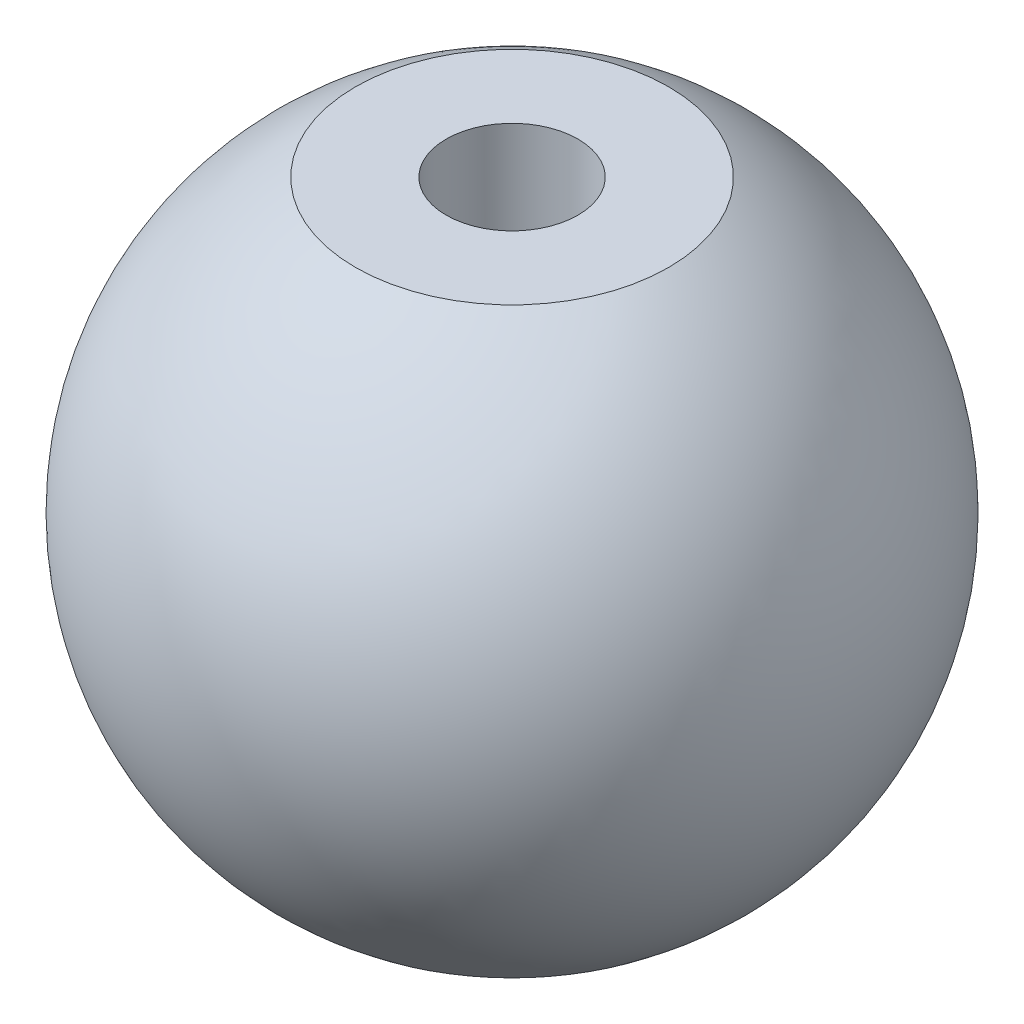
from build123d import *

# Parameters (mm, degrees)
TROU_TARAUD_M61_D     = 5
TROU_TARAUD_M61_DEPTH = 20
TROU_TARAUD_M61_TIP   = 1.502151548
EXTRUSION1_DEPTH      = 22.650635095
EXTRUSION1_DEPTH_BACK = 22.650635095
ESQUISSE5_W           = 11.874342088
ESQUISSE5_H           = 3.786271938


with BuildPart() as part:
    # Esquisse1 → Révolution1 (revolve)
    with BuildSketch(Plane.XY):
        with BuildLine():
            Line((0, -12.5), (0, 12.5))
            ThreePointArc((0, 12.5), (12.5, 0), (0, -12.5))
        make_face()
    revolve(axis=Axis((0, 81.368836261, 0), (0, -1, 0)))

    # Trou taraudé M61
    with Locations(Plane(origin=(0, 12.5, 0), x_dir=(-1, 0, 0), z_dir=(0, 1, 0))):
        with Locations((0, 0)):
            Hole(TROU_TARAUD_M61_D / 2, depth=TROU_TARAUD_M61_DEPTH)
            with Locations((0, 0, -(TROU_TARAUD_M61_DEPTH + TROU_TARAUD_M61_TIP / 2))):  # 118° drill point
                Cone(0, TROU_TARAUD_M61_D / 2, TROU_TARAUD_M61_TIP, mode=Mode.SUBTRACT)

    # Esquisse5 → Extrusion1 (cut, two sides: drawn at the far end of the back side and taken through both)
    with BuildSketch(Plane.XY.offset(-EXTRUSION1_DEPTH_BACK)):
        with Locations((0, 12.893135969)):
            Rectangle(ESQUISSE5_W, ESQUISSE5_H)
    extrude(amount=EXTRUSION1_DEPTH + EXTRUSION1_DEPTH_BACK, mode=Mode.SUBTRACT)


solid = part.part
